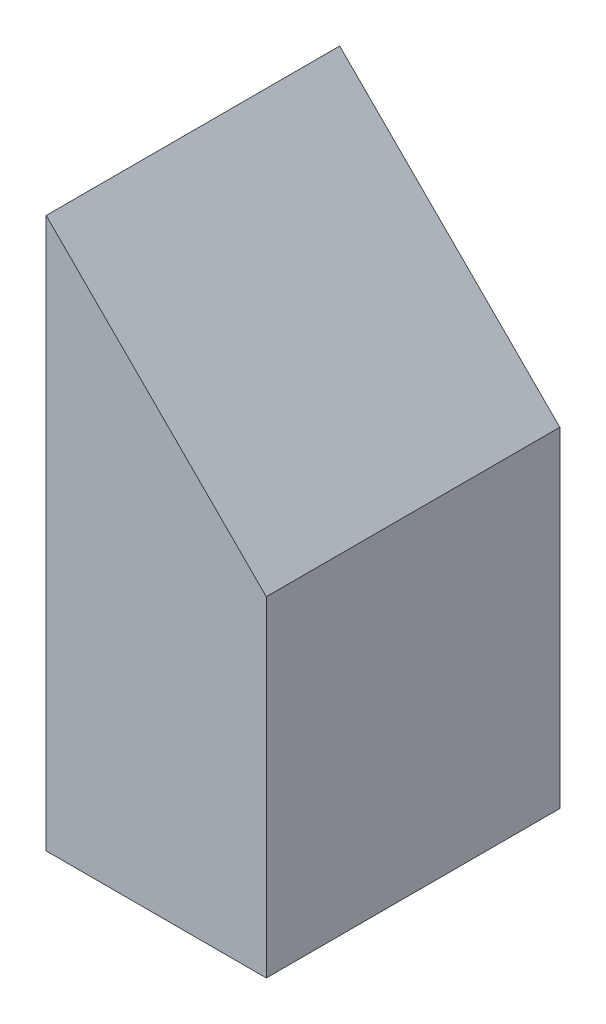
from build123d import *

# Parameters (mm, degrees)
SKETCH1_W               = 38.1
SKETCH1_H               = 50.8
BOSS_EXTRUDE1_DEPTH     = 95.25
CUT_EXTRUDE1_DEPTH      = 101.40231571
CUT_EXTRUDE1_DEPTH_BACK = 101.40231571


with BuildPart() as part:
    # Sketch1 → Boss-Extrude1 (new body)
    with BuildSketch(Plane(origin=(0, 0, 0), x_dir=(1, 0, 0), z_dir=(0, 1, 0))):
        Rectangle(SKETCH1_W, SKETCH1_H)
    extrude(amount=BOSS_EXTRUDE1_DEPTH)

    # Sketch2 → Cut-Extrude1 (cut, two sides: drawn at the far end of the back side and taken through both)
    with BuildSketch(Plane.XY.offset(-CUT_EXTRUDE1_DEPTH_BACK)):
        Polygon((-171.201545479, 247.401545479), (-19.05, 95.25), (19.05, 57.15), (171.201545479, -95.001545479), (475.504636436, 209.301545479), (133.101545479, 551.704636436), align=None)
    extrude(amount=CUT_EXTRUDE1_DEPTH + CUT_EXTRUDE1_DEPTH_BACK, mode=Mode.SUBTRACT)


solid = part.part
